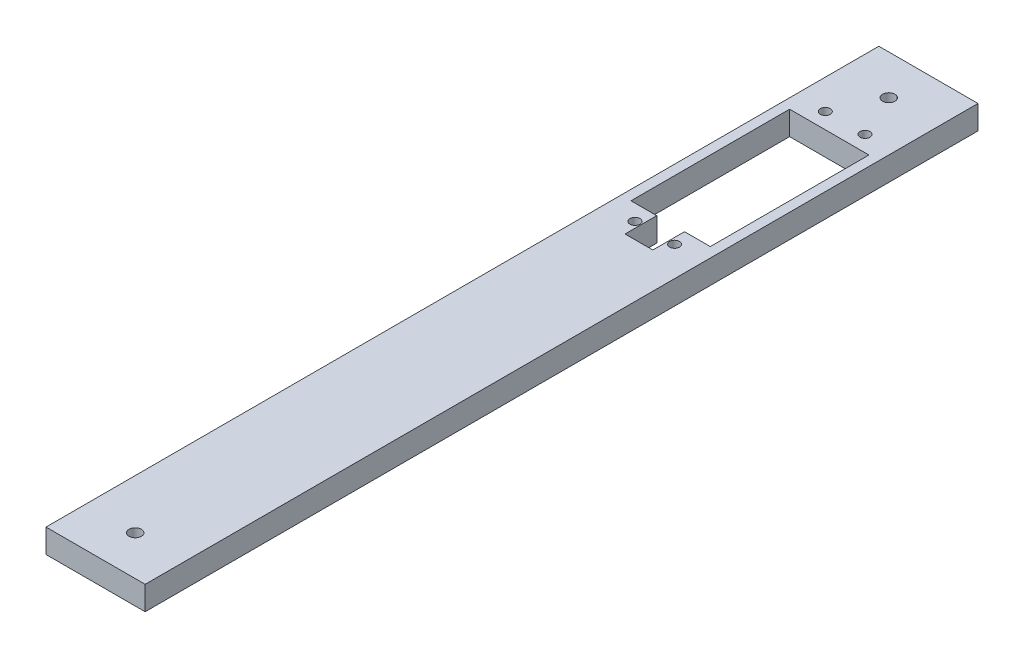
from build123d import *

# Parameters (mm, degrees)
SKETCH_1_W          = 25
SKETCH_1_H          = 210
EXTRUDE_1_DEPTH     = 6
SKETCH_2_R          = 1.55
CUT_EXTRUDE_1_DEPTH = 6
SKETCH_3_R          = 1.25
CUT_EXTRUDE_2_DEPTH = 6


with BuildPart() as part:
    # Эскиз1 → Бобышка-Вытянуть1 (new body)
    with BuildSketch(Plane(origin=(0, 0, 0), x_dir=(1, 0, 0), z_dir=(0, 1, 0))):
        with Locations((-3.127715508, -90.396451994)):
            Rectangle(SKETCH_1_W, SKETCH_1_H)
    extrude(amount=EXTRUDE_1_DEPTH)

    # Эскиз2 → Вырез-Вытянуть1 (cut)
    with BuildSketch(Plane(origin=(0, 6, 0), x_dir=(1, 0, 0), z_dir=(0, 1, 0))):
        with Locations(Location((-3.127715508, 4.603548006, 0), (0, 0, 270))):
            Circle(SKETCH_2_R)
        with Locations(Location((-3.127715508, -185.396451994, 0), (0, 0, 90))):
            Circle(SKETCH_2_R)
    extrude(amount=-CUT_EXTRUDE_1_DEPTH, mode=Mode.SUBTRACT)

    # Эскиз3 → Вырез-Вытянуть2 (cut)
    with BuildSketch(Plane(origin=(0, 6, 0), x_dir=(1, 0, 0), z_dir=(0, 1, 0))):
        with Locations(Location((-8.127715508, -54.396451994, 0), (0, 0, 270))):
            Circle(SKETCH_3_R)
        with Locations(Location((1.872284492, -54.396451994, 0), (0, 0, 90))):
            Circle(SKETCH_3_R)
        with Locations(Location((1.872284492, -6.396451994, 0), (0, 0, 270))):
            Circle(SKETCH_3_R)
        with Locations(Location((-8.127715508, -6.396451994, 0), (0, 0, 90))):
            Circle(SKETCH_3_R)
        Polygon((-13.127715508, -10.396451994), (6.872284492, -10.396451994), (6.872284492, -50.396451994), (0.372284492, -50.396451994), (0.372284492, -58.396451994), (-6.627715508, -58.396451994), (-6.627715508, -50.396451994), (-13.127715508, -50.396451994), align=None)
    extrude(amount=-CUT_EXTRUDE_2_DEPTH, mode=Mode.SUBTRACT)


solid = part.part
